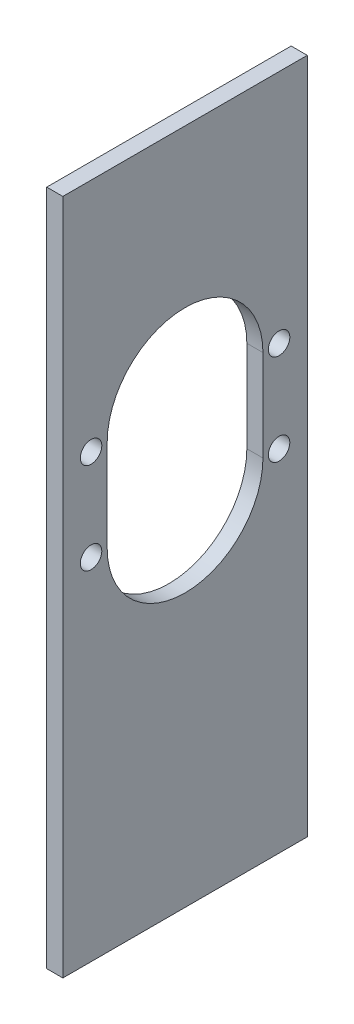
from build123d import *

# Parameters (mm, degrees)
SKETCH1_W           = 45.5
SKETCH1_H           = 126
SKETCH1_R           = 2
BOSS_EXTRUDE1_DEPTH = 3


with BuildPart() as part:
    # Sketch1 → Boss-Extrude1 (new body)
    with BuildSketch(Plane(origin=(0, 0, 0), x_dir=(0, 0, -1), z_dir=(1, 0, 0))):
        with Locations((22.75, -63)):
            Rectangle(SKETCH1_W, SKETCH1_H)
        with Locations((5.25, -60.8)):
            Circle(SKETCH1_R, mode=Mode.SUBTRACT)
        with Locations((40.25, -60.8)):
            Circle(SKETCH1_R, mode=Mode.SUBTRACT)
        with Locations(Location((40.25, -43.8, 0), (0, 0, 180))):
            Circle(SKETCH1_R, mode=Mode.SUBTRACT)
        with Locations(Location((5.25, -43.8, 0), (0, 0, 180))):
            Circle(SKETCH1_R, mode=Mode.SUBTRACT)
        with BuildLine():
            Line((8.25, -60.8), (8.25, -43.8))
            ThreePointArc((8.25, -43.8), (22.75, -29.3), (37.25, -43.8))
            Line((37.25, -43.8), (37.25, -60.8))
            ThreePointArc((37.25, -60.8), (22.75, -75.3), (8.25, -60.8))
        make_face(mode=Mode.SUBTRACT)
    extrude(amount=BOSS_EXTRUDE1_DEPTH)


solid = part.part
